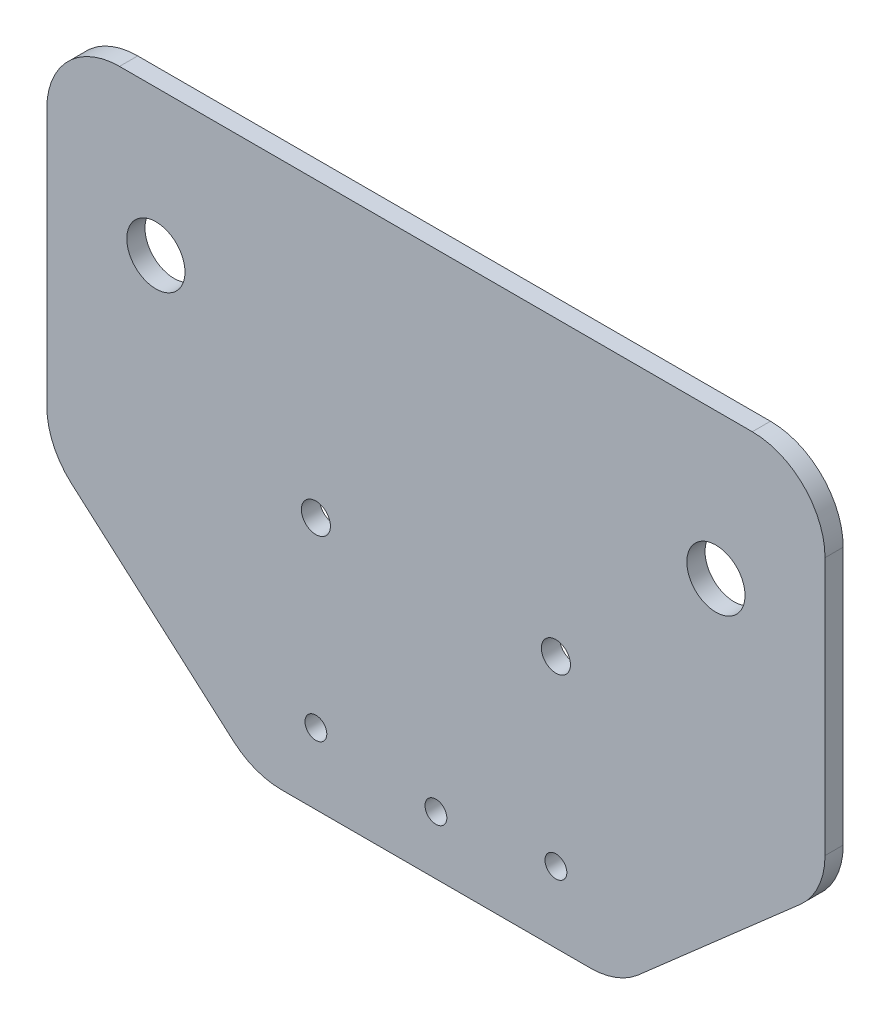
from build123d import *

# Parameters (mm, degrees)
SKETCH1_3_R         = 1.5
SKETCH1_3_R_2       = 2
SKETCH1_3_R_3       = 4
BOSS_EXTRUDE2_DEPTH = 1.25
FILLET2_R           = 10


with BuildPart() as part:
    # Sketch1<3> → Boss-Extrude2 (new, symmetric)
    with BuildSketch(Plane.XY):
        Polygon((53.5, -12.5), (53.5, 37.5), (-53.5, 37.5), (-53.5, -12.5), (-25, -37.5), (25, -37.5), align=None)
        with Locations((0, -29.5)):
            Circle(SKETCH1_3_R, mode=Mode.SUBTRACT)
        with Locations((-16.5, -27.75)):
            Circle(SKETCH1_3_R, mode=Mode.SUBTRACT)
        with Locations((16.5, -27.75)):
            Circle(SKETCH1_3_R, mode=Mode.SUBTRACT)
        with Locations((16.5, -2.75)):
            Circle(SKETCH1_3_R_2, mode=Mode.SUBTRACT)
        with Locations((-38.5, 17.5)):
            Circle(SKETCH1_3_R_3, mode=Mode.SUBTRACT)
        with Locations((38.5, 17.5)):
            Circle(SKETCH1_3_R_3, mode=Mode.SUBTRACT)
        with Locations((-16.5, -2.75)):
            Circle(SKETCH1_3_R_2, mode=Mode.SUBTRACT)
    extrude(amount=BOSS_EXTRUDE2_DEPTH, both=True)

    # Fillet2
    fillet2_edges = [part.edges().sort_by_distance(p)[0] for p in [
        (53.5, -12.5, 0),
        (25, -37.5, 0),
        (-25, -37.5, 0),
        (-53.5, -12.5, 0),
        (-53.5, 37.5, 0),
        (53.5, 37.5, 0),
    ]]
    fillet(fillet2_edges, radius=FILLET2_R)


solid = part.part
